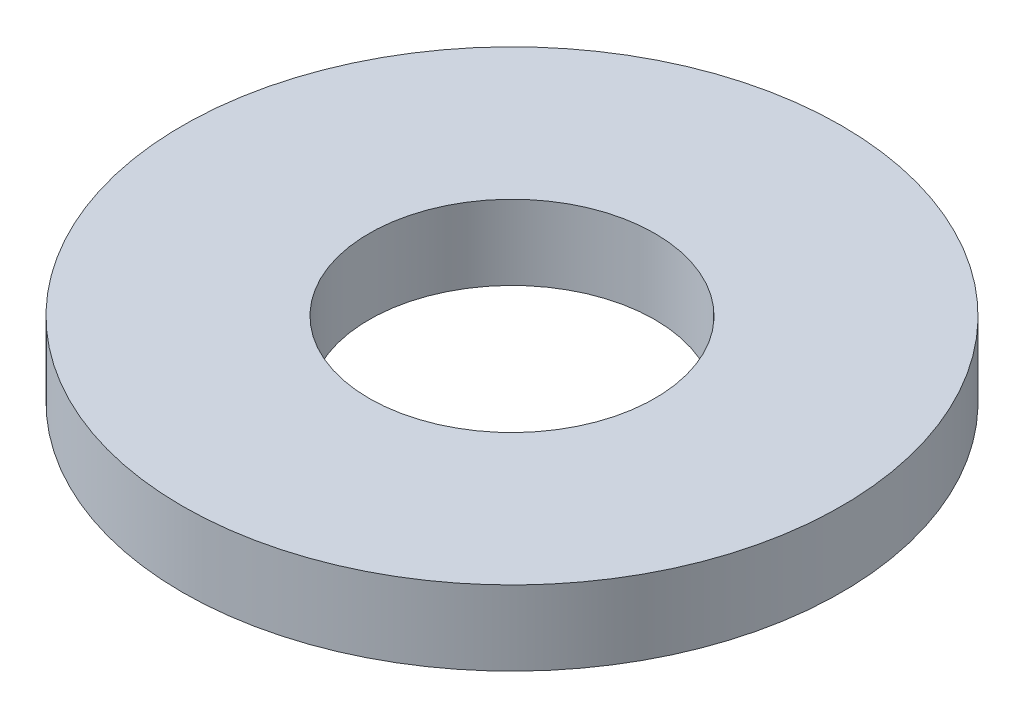
from build123d import *

# Parameters (mm, degrees)
SKETCH1_R      = 68.52
SKETCH1_R_2    = 29.71
EXTRUDE1_DEPTH = 15.524


with BuildPart() as part:
    # Sketch1 → Extrude1 (new body)
    with BuildSketch(Plane(origin=(0, 0, 0), x_dir=(1, 0, 0), z_dir=(0, 1, 0))):
        with Locations(Location((0, 0, 0), (0, 0, 90))):
            Circle(SKETCH1_R)
        with Locations(Location((0, 0, 0), (0, 0, 90))):
            Circle(SKETCH1_R_2, mode=Mode.SUBTRACT)
    extrude(amount=EXTRUDE1_DEPTH)


solid = part.part
